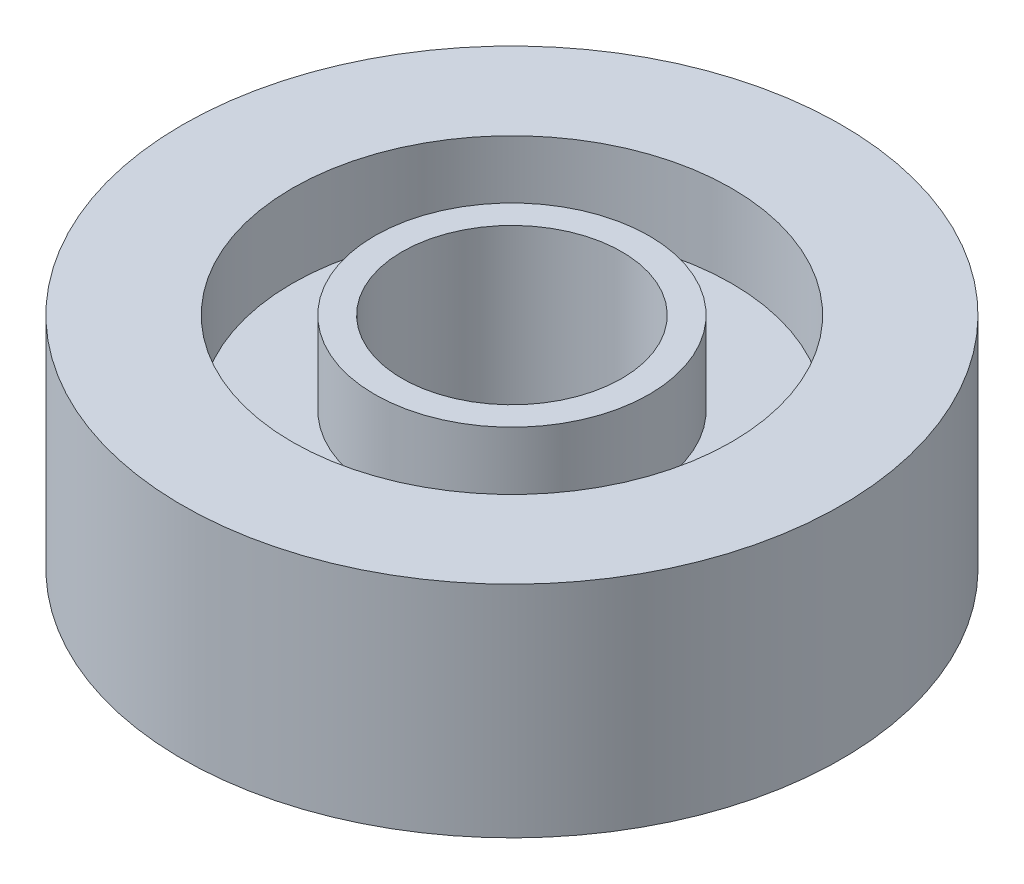
from build123d import *


with BuildPart() as part:
    # Sketch1 → Revolve1 (revolve)
    with BuildSketch(Plane.XY, mode=Mode.PRIVATE) as revolve1_sk:
        Polygon((1.102742578, -4), (2.102742578, -4), (2.102742578, -1), (5.102742578, -1), (5.102742578, -4), (9.102742578, -4), (9.102742578, 4), (5.102742578, 4), (5.102742578, 1), (2.102742578, 1), (2.102742578, 4), (1.102742578, 4), align=None)
    revolve(revolve1_sk.sketch.rotate(Axis((-2.897257422, 6.36964268, 0), (0, -1, 0)), 180), axis=Axis((-2.897257422, 6.36964268, 0), (0, -1, 0)))


solid = part.part
